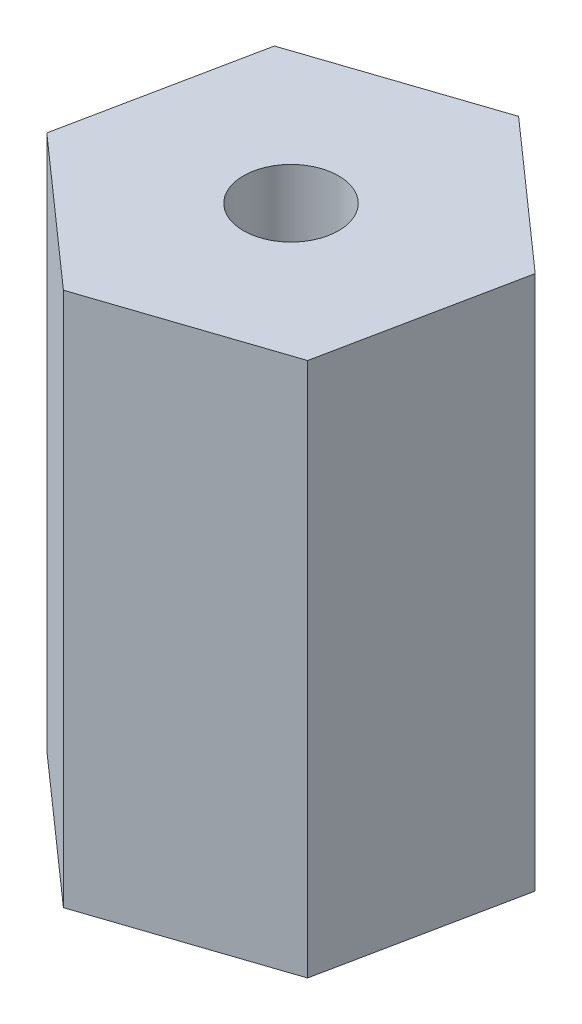
from build123d import *

# Parameters (mm, degrees)
BOSS_EXTRUDE1_DEPTH       = 12.7
F_4_40_TAPPED_HOLE1_D     = 2.2606
F_4_40_TAPPED_HOLE1_DEPTH = 3.571875
F_4_40_TAPPED_HOLE1_TIP   = 0.679152758
F_6_32_TAPPED_HOLE1_D     = 2.7051
F_6_32_TAPPED_HOLE1_DEPTH = 3.556
F_6_32_TAPPED_HOLE1_TIP   = 0.81269403


with BuildPart() as part:
    # Sketch1 → Boss-Extrude1 (new body)
    with BuildSketch(Plane(origin=(0, 0, 0), x_dir=(1, 0, 0), z_dir=(0, 1, 0))):
        Polygon((3.431522356, -3.037425951), (4.346249213, 1.453072558), (0.914726858, 4.490498509), (-3.431522356, 3.037425951), (-4.346249213, -1.453072558), (-0.914726858, -4.490498509), align=None)
    extrude(amount=BOSS_EXTRUDE1_DEPTH)

    # #4-40 Tapped Hole1
    with Locations(Plane(origin=(0, 12.7, 0), x_dir=(1, 0, 0), z_dir=(0, 1, 0))):
        with Locations((0, 0)):
            Hole(F_4_40_TAPPED_HOLE1_D / 2, depth=F_4_40_TAPPED_HOLE1_DEPTH)
            with Locations((0, 0, -(F_4_40_TAPPED_HOLE1_DEPTH + F_4_40_TAPPED_HOLE1_TIP / 2))):  # 118° drill point
                Cone(0, F_4_40_TAPPED_HOLE1_D / 2, F_4_40_TAPPED_HOLE1_TIP, mode=Mode.SUBTRACT)

    # #6-32 Tapped Hole1
    with Locations(Plane(origin=(0, 0, 0), x_dir=(-1, 0, 0), z_dir=(0, -1, 0))):
        with Locations((0, 0)):
            Hole(F_6_32_TAPPED_HOLE1_D / 2, depth=F_6_32_TAPPED_HOLE1_DEPTH)
            with Locations((0, 0, -(F_6_32_TAPPED_HOLE1_DEPTH + F_6_32_TAPPED_HOLE1_TIP / 2))):  # 118° drill point
                Cone(0, F_6_32_TAPPED_HOLE1_D / 2, F_6_32_TAPPED_HOLE1_TIP, mode=Mode.SUBTRACT)


solid = part.part
